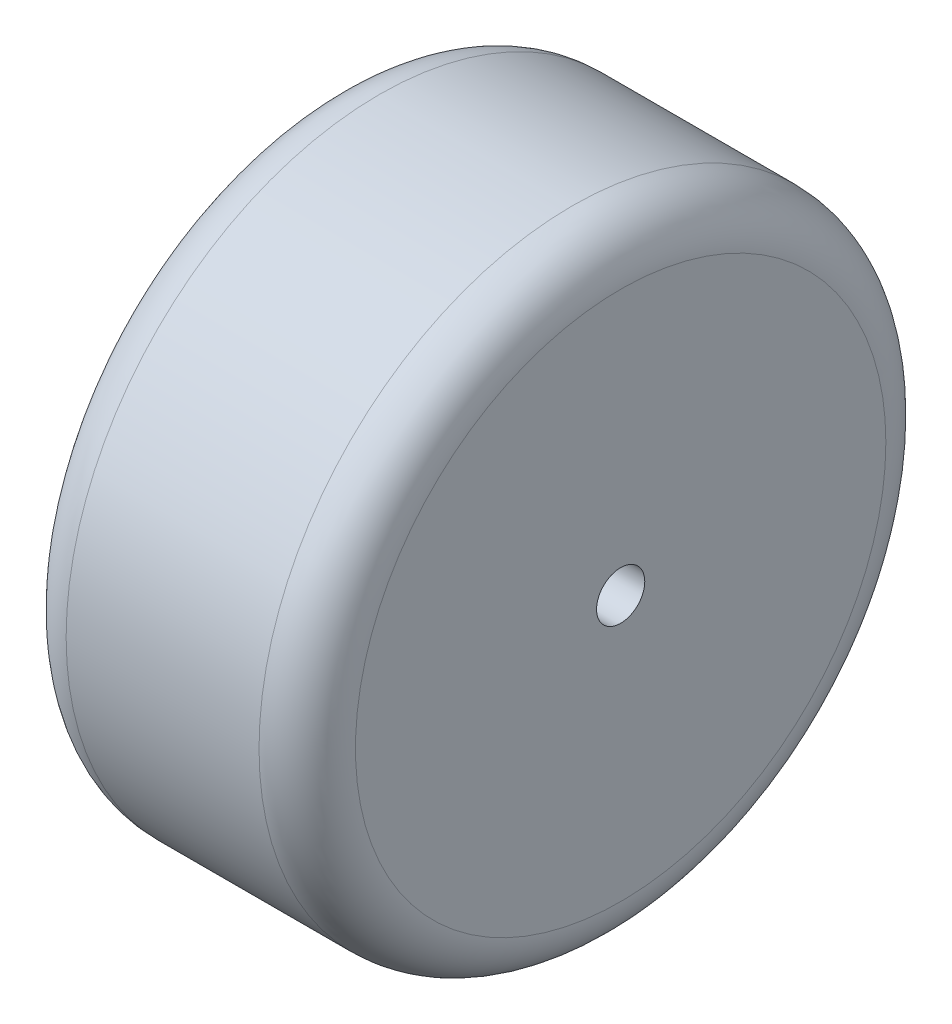
from build123d import *

# Parameters (mm, degrees)
SKETCH_1_R      = 32.5
SKETCH_1_R_2    = 2.5
EXTRUDE_1_DEPTH = 30
FILLET_1_R      = 5


with BuildPart() as part:
    # 草圖1 → 填料-伸長1 (new body)
    with BuildSketch(Plane(origin=(0, 0, 0), x_dir=(0, 0, -1), z_dir=(1, 0, 0))):
        Circle(SKETCH_1_R)
        Circle(SKETCH_1_R_2, mode=Mode.SUBTRACT)
    extrude(amount=EXTRUDE_1_DEPTH)

    # 圓角1
    fillet_1_edges = [part.edges().sort_by_distance(p)[0] for p in [
        (0, 0, 32.5),
        (30, 0, 32.5),
    ]]
    fillet(fillet_1_edges, radius=FILLET_1_R)


solid = part.part
